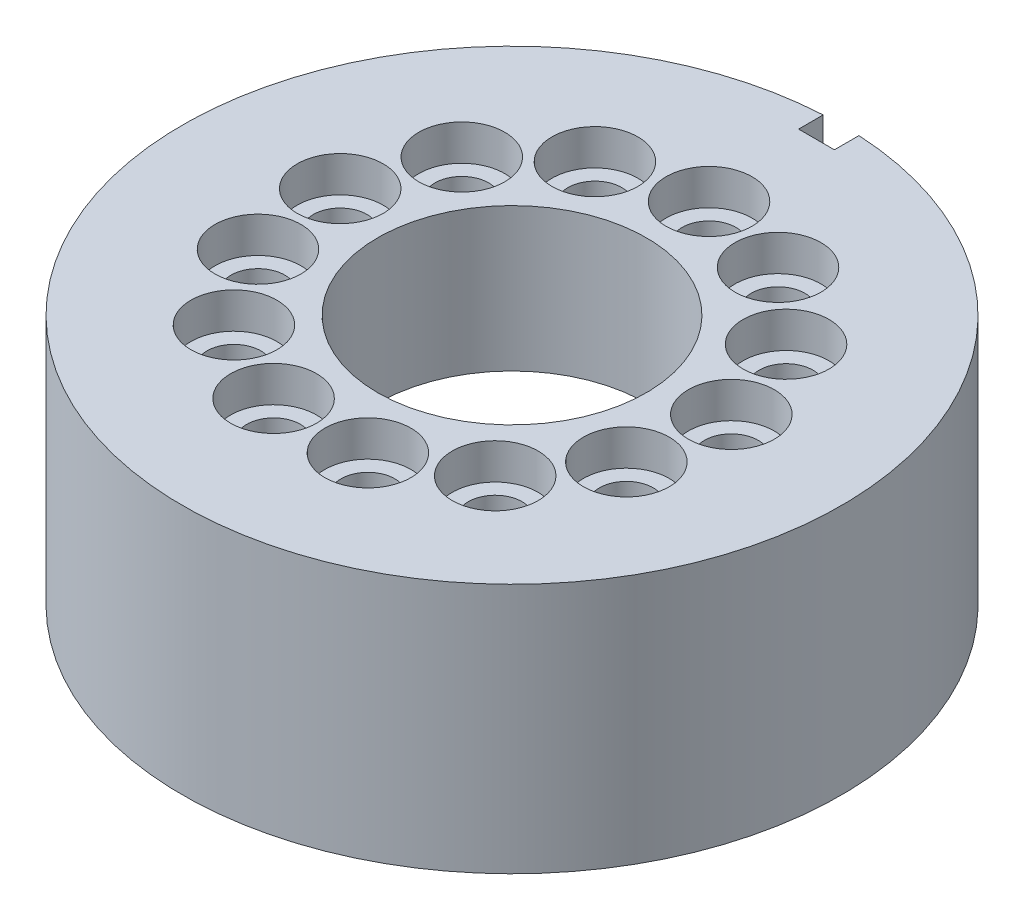
from build123d import *

# Parameters (mm, degrees)
SKETCH_1_R          = 9.2
SKETCH_1_R_2        = 0.75
EXTRUDE_1_DEPTH     = 7
SKETCH_2_W          = 1
SKETCH_2_H          = 0.798143387
CUT_EXTRUDE_1_DEPTH = 7.5
SKETCH_6_R          = 3.75
CUT_EXTRUDE_3_DEPTH = 5
SKETCH_7_R          = 1.2
CUT_EXTRUDE_4_DEPTH = 1


with BuildPart() as part:
    # 草图1 → 凸台-拉伸1 (new body)
    with BuildSketch(Plane(origin=(0, 0, 0), x_dir=(1, 0, 0), z_dir=(0, 1, 0))):
        with Locations(Location((0, 0, 0), (0, 0, 270))):
            Circle(SKETCH_1_R)
        with Locations(Location((0, 5.5, 0), (0, 0, 270))):
            Circle(SKETCH_1_R_2, mode=Mode.SUBTRACT)
        with Locations(Location((2.555977446, 4.870008141, 0), (0, 0, 270))):
            Circle(SKETCH_1_R_2, mode=Mode.SUBTRACT)
        with Locations(Location((4.526411262, 3.124356107, 0), (0, 0, 270))):
            Circle(SKETCH_1_R_2, mode=Mode.SUBTRACT)
        with Locations(Location((5.459898808, 0.662951741, 0), (0, 0, 270))):
            Circle(SKETCH_1_R_2, mode=Mode.SUBTRACT)
        with Locations(Location((5.142589335, -1.950326879, 0), (0, 0, 270))):
            Circle(SKETCH_1_R_2, mode=Mode.SUBTRACT)
        with Locations(Location((3.64717462, -4.116809115, 0), (0, 0, 270))):
            Circle(SKETCH_1_R_2, mode=Mode.SUBTRACT)
        with Locations(Location((1.316236154, -5.340179996, 0), (0, 0, 270))):
            Circle(SKETCH_1_R_2, mode=Mode.SUBTRACT)
        with Locations(Location((-1.316236154, -5.340179996, 0), (0, 0, 270))):
            Circle(SKETCH_1_R_2, mode=Mode.SUBTRACT)
        with Locations(Location((-3.64717462, -4.116809115, 0), (0, 0, 270))):
            Circle(SKETCH_1_R_2, mode=Mode.SUBTRACT)
        with Locations(Location((-5.142589335, -1.950326879, 0), (0, 0, 270))):
            Circle(SKETCH_1_R_2, mode=Mode.SUBTRACT)
        with Locations(Location((-5.459898808, 0.662951741, 0), (0, 0, 270))):
            Circle(SKETCH_1_R_2, mode=Mode.SUBTRACT)
        with Locations(Location((-4.526411262, 3.124356107, 0), (0, 0, 270))):
            Circle(SKETCH_1_R_2, mode=Mode.SUBTRACT)
        with Locations(Location((-2.555977446, 4.870008141, 0), (0, 0, 270))):
            Circle(SKETCH_1_R_2, mode=Mode.SUBTRACT)
    extrude(amount=EXTRUDE_1_DEPTH)

    # 草图2 → 切除-拉伸1 (cut)
    with BuildSketch(Plane(origin=(0, 7, 0), x_dir=(1, 0, 0), z_dir=(0, 1, 0))):
        with Locations((0, 8.899071694)):
            Rectangle(SKETCH_2_W, SKETCH_2_H)
    extrude(amount=-CUT_EXTRUDE_1_DEPTH, mode=Mode.SUBTRACT)

    # 草图5 → 切除-旋转1 (revolve, cut)
    with BuildSketch(Plane(origin=(0, 0, 0), x_dir=(0, 0, -1), z_dir=(1, 0, 0))):
        with BuildLine():
            Line((-6, 3), (0, 3))
            Line((0, 3), (0, 0))
            Line((0, 0), (-9, 0))
            add(Edge.make_bspline(
                [(-9, 0), (-8.384481944, 1.295897354), (-7.512154342, 2.632195528), (-6, 3)],
                knots=[0, 0, 0, 0, 1, 1, 1, 1], degree=3))
        make_face()
    revolve(axis=Axis((0, 3, 0), (0, -1, 0)), mode=Mode.SUBTRACT)

    # 草图6 → 切除-拉伸3 (cut)
    with BuildSketch(Plane(origin=(0, 7, 0), x_dir=(1, 0, 0), z_dir=(0, 1, 0))):
        with Locations(Location((0, 0, 0), (0, 0, 270))):
            Circle(SKETCH_6_R)
    extrude(amount=-CUT_EXTRUDE_3_DEPTH, mode=Mode.SUBTRACT)

    # 草图7 → 切除-拉伸4 (cut)
    with BuildSketch(Plane(origin=(0, 7, 0), x_dir=(1, 0, 0), z_dir=(0, 1, 0))):
        with Locations(Location((0, 5.5, 0), (0, 0, 270))):
            Circle(SKETCH_7_R)
        with Locations(Location((2.555977446, 4.870008141, 0), (0, 0, 270))):
            Circle(SKETCH_7_R)
        with Locations(Location((4.526411262, 3.124356107, 0), (0, 0, 270))):
            Circle(SKETCH_7_R)
        with Locations(Location((5.459898808, 0.662951741, 0), (0, 0, 270))):
            Circle(SKETCH_7_R)
        with Locations(Location((5.142589335, -1.950326879, 0), (0, 0, 270))):
            Circle(SKETCH_7_R)
        with Locations(Location((3.64717462, -4.116809115, 0), (0, 0, 270))):
            Circle(SKETCH_7_R)
        with Locations(Location((1.316236154, -5.340179996, 0), (0, 0, 270))):
            Circle(SKETCH_7_R)
        with Locations(Location((-1.316236154, -5.340179996, 0), (0, 0, 270))):
            Circle(SKETCH_7_R)
        with Locations(Location((-3.64717462, -4.116809115, 0), (0, 0, 270))):
            Circle(SKETCH_7_R)
        with Locations(Location((-5.142589335, -1.950326879, 0), (0, 0, 270))):
            Circle(SKETCH_7_R)
        with Locations(Location((-5.459898808, 0.662951741, 0), (0, 0, 270))):
            Circle(SKETCH_7_R)
        with Locations(Location((-4.526411262, 3.124356107, 0), (0, 0, 270))):
            Circle(SKETCH_7_R)
        with Locations(Location((-2.555977446, 4.870008141, 0), (0, 0, 270))):
            Circle(SKETCH_7_R)
    extrude(amount=-CUT_EXTRUDE_4_DEPTH, mode=Mode.SUBTRACT)


solid = part.part
